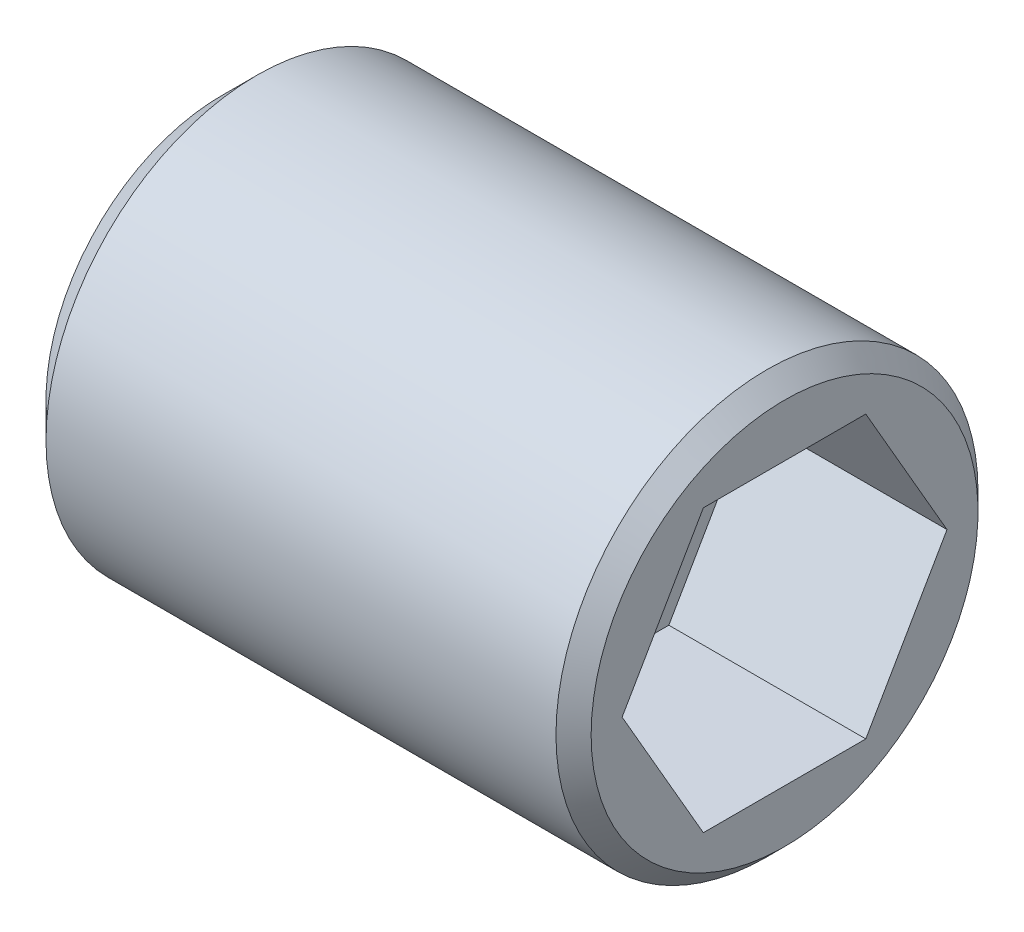
from build123d import *

# Parameters (mm, degrees)
ESQUISSE1_W             = 8
ESQUISSE1_H             = 3
CHANFREIN2_SIZE         = 0.5
EMPREINTE_POUR_CL_DEPTH = 2.8
CHANFREIN3_SIZE         = 0.25


with BuildPart() as part:
    # Esquisse1 → Base-Révolution (revolve)
    with BuildSketch(Plane.XY, mode=Mode.PRIVATE) as base_r_volution_sk:
        with Locations((4, 1.5)):
            Rectangle(ESQUISSE1_W, ESQUISSE1_H)
    revolve(base_r_volution_sk.sketch.rotate(Axis((-25.828475034, 0, 0), (1, 0, 0)), 90), axis=Axis((-25.828475034, 0, 0), (1, 0, 0)))

    # Chanfrein2
    chanfrein2_edges = [part.edges().sort_by_distance(p)[0] for p in [
        (0, 0, -3),
    ]]
    chamfer(chanfrein2_edges, length=CHANFREIN2_SIZE)

    # Esquisse2 → Empreinte pour clé (cut)
    with BuildSketch(Plane(origin=(8, 0, 0), x_dir=(0, 0, -1), z_dir=(1, 0, 0))):
        Polygon((2.309401077, 0), (1.154700538, 2), (-1.154700538, 2), (-2.309401077, 0), (-1.154700538, -2), (1.154700538, -2), align=None)
    extrude(amount=-EMPREINTE_POUR_CL_DEPTH, mode=Mode.SUBTRACT)

    # Chanfrein3
    chanfrein3_edges = [part.edges().sort_by_distance(p)[0] for p in [
        (8, 0, -3),
    ]]
    chamfer(chanfrein3_edges, length=CHANFREIN3_SIZE)


solid = part.part
